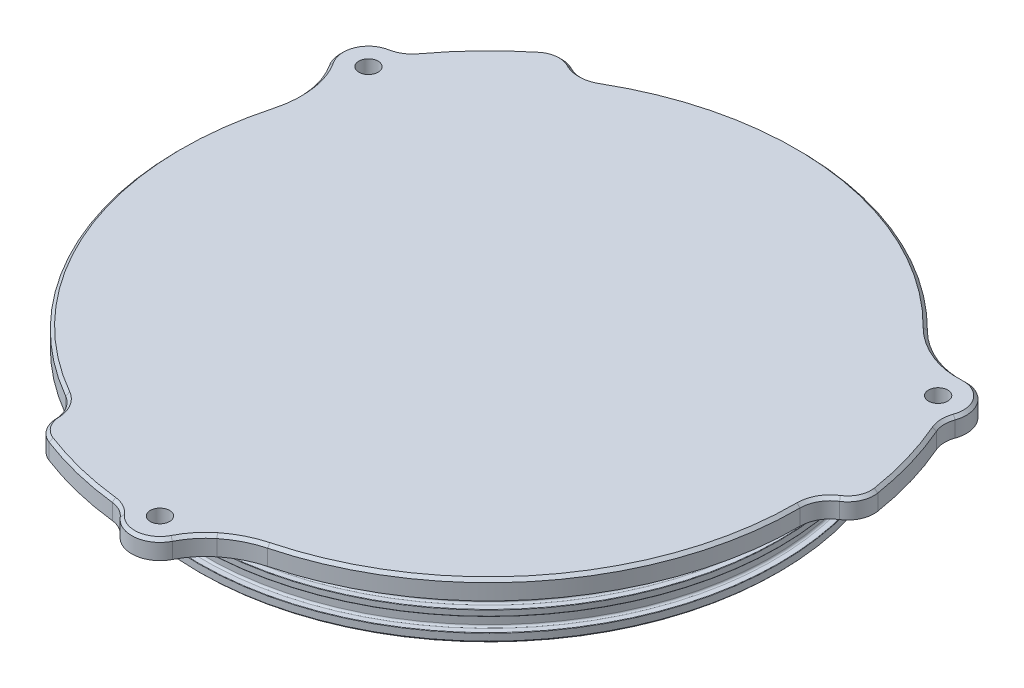
from build123d import *

# Parameters (mm, degrees)
CHAMFER1_SIZE           = 0.635
BOSS_EXTRUDE2_START     = -6.35
BOSS_EXTRUDE2_DEPTH     = 6.35
F_1_4_CLEARANCE_HOLE1_D = 6.5278
CIRPATTERN2_COUNT       = 3
CHAMFER2_SIZE           = 1.016


with BuildPart() as part:
    # Sketch1 → Revolve1 (revolve)
    with BuildSketch(Plane.XY, mode=Mode.PRIVATE) as revolve1_sk:
        with BuildLine():
            Line((0, 0), (-104.775, 0))
            Line((-104.775, 0), (-104.775, -6.35))
            Line((-104.775, -6.35), (-98.7298, -6.35))
            ThreePointArc((-98.7298, -6.35), (-98.280787194, -6.535987194), (-98.0948, -6.985))
            Line((-98.0948, -6.985), (-98.0948, -8.763))
            ThreePointArc((-98.0948, -8.763), (-98.057602561, -8.852802561), (-97.9678, -8.89))
            Line((-97.9678, -8.89), (-96.2152, -8.89))
            ThreePointArc((-96.2152, -8.89), (-95.766187194, -9.075987194), (-95.5802, -9.525))
            Line((-95.5802, -9.525), (-95.5802, -13.0048))
            ThreePointArc((-95.5802, -13.0048), (-95.766187194, -13.453812806), (-96.2152, -13.6398))
            Line((-96.2152, -13.6398), (-97.9678, -13.6398))
            ThreePointArc((-97.9678, -13.6398), (-98.057602561, -13.676997439), (-98.0948, -13.7668))
            Line((-98.0948, -13.7668), (-98.0948, -15.5448))
            ThreePointArc((-98.0948, -15.5448), (-98.057602561, -15.634602561), (-97.9678, -15.6718))
            Line((-97.9678, -15.6718), (-96.2152, -15.6718))
            ThreePointArc((-96.2152, -15.6718), (-95.766187194, -15.857787194), (-95.5802, -16.3068))
            Line((-95.5802, -16.3068), (-95.5802, -19.7866))
            ThreePointArc((-95.5802, -19.7866), (-95.766187194, -20.235612806), (-96.2152, -20.4216))
            Line((-96.2152, -20.4216), (-97.9678, -20.4216))
            ThreePointArc((-97.9678, -20.4216), (-98.057602561, -20.458797439), (-98.0948, -20.5486))
            Line((-98.0948, -20.5486), (-98.0948, -23.495))
            Line((-98.0948, -23.495), (-90.17, -23.495))
            Line((-90.17, -23.495), (-90.17, -6.35))
            Line((-90.17, -6.35), (0, -6.35))
            Line((0, -6.35), (0, 0))
        make_face()
    revolve(revolve1_sk.sketch.rotate(Axis((0, 0, 0), (0, 1, 0)), 270), axis=Axis((0, 0, 0), (0, 1, 0)))

    # Chamfer1
    chamfer1_edges = [part.edges().sort_by_distance(p)[0] for p in [
        (0, -23.495, 98.0948),
    ]]
    chamfer(chamfer1_edges, length=CHAMFER1_SIZE)

    # Sketch3 → Boss-Extrude2 (add)
    with BuildSketch(Plane(origin=(0, 0, 0), x_dir=(1, 0, 0), z_dir=(0, 1, 0)).offset(BOSS_EXTRUDE2_START)):
        with BuildLine():
            ThreePointArc((105.202124176, 52.344817242), (103.870171196, 61.25999391), (95.701964649, 65.072457101))
            ThreePointArc((95.701964649, 65.072457101), (90.320946661, 65.341998135), (85.117835782, 66.740441606))
            ThreePointArc((85.117835782, 66.740441606), (79.41397091, 69.667943629), (74.448653582, 73.723799447))
            ThreePointArc((74.448653582, 73.723799447), (96.830552801, 40.020553084), (104.774415433, 0.349993792))
            ThreePointArc((104.774415433, 0.349993792), (106.027280411, 5.271626878), (109.505684763, 8.972011459))
            ThreePointArc((109.505684763, 8.972011459), (112.852906073, 12.817022763), (113.537501196, 17.868689018))
            ThreePointArc((113.537501196, 17.868689018), (110.363783258, 32.091892591), (105.415797207, 45.799169471))
            ThreePointArc((105.415797207, 45.799169471), (104.684238087, 49.051600208), (105.202124176, 52.344817242))
        make_face()
    boss_extrude2 = extrude(amount=BOSS_EXTRUDE2_DEPTH)

    # 1/4 Clearance Hole1 (through all)
    with Locations(Plane(origin=(0, 0, 0), x_dir=(-1, 0, 0), z_dir=(0, 1, 0))):
        with Locations((-96.237072996, -55.5625)):
            f_1_4_clearance_hole1 = Hole(F_1_4_CLEARANCE_HOLE1_D / 2)

    # CirPattern2: Boss-Extrude2, 1/4 Clearance Hole1 ×3 about axis
    cirpattern2_axis = Axis((0, 0, 0), (0, 1, 0))
    add([boss_extrude2.rotate(cirpattern2_axis, i * 360 / CIRPATTERN2_COUNT) for i in range(1, CIRPATTERN2_COUNT)])
    add([f_1_4_clearance_hole1.rotate(cirpattern2_axis, i * 360 / CIRPATTERN2_COUNT) for i in range(1, CIRPATTERN2_COUNT)], mode=Mode.SUBTRACT)

    # Chamfer2
    chamfer2_edges = [part.edges().sort_by_distance(p)[0] for p in [
        (-57.579003001, 0, -89.186504891),
        (-67.526320351, 0, -91.324972169),
        (-82.974285868, 0, -79.531893663),
        (-94.82205092, 0, -66.133409456),
        (-104.98779656, 0, -59.324209996),
        (-101.748303649, 0, -45.549235235),
        (-100.041194467, 0, -33.940544408),
        (83.074092045, 0, 63.847442046),
        (106.027280411, 0, -5.271626878),
        (112.852906073, 0, -12.817022763),
        (110.363783258, 0, -32.091892591),
        (104.684238087, 0, -49.051600208),
        (103.870171196, 0, -61.25999391),
        (90.320946661, 0, -65.341998135),
        (79.41397091, 0, -69.667943629),
        (-96.830552801, 0, 40.020553084),
        (-48.44827741, 0, 94.458131769),
        (-45.326585723, 0, 104.141994932),
        (-27.389497389, 0, 111.623786254),
        (-9.862187168, 0, 115.185009663),
        (1.117625364, 0, 120.584203907),
        (11.427356988, 0, 110.891233369),
        (20.627223558, 0, 103.608488038),
        (13.756460756, 0, -103.867995131),
    ]]
    chamfer(chamfer2_edges, length=CHAMFER2_SIZE)


solid = part.part
